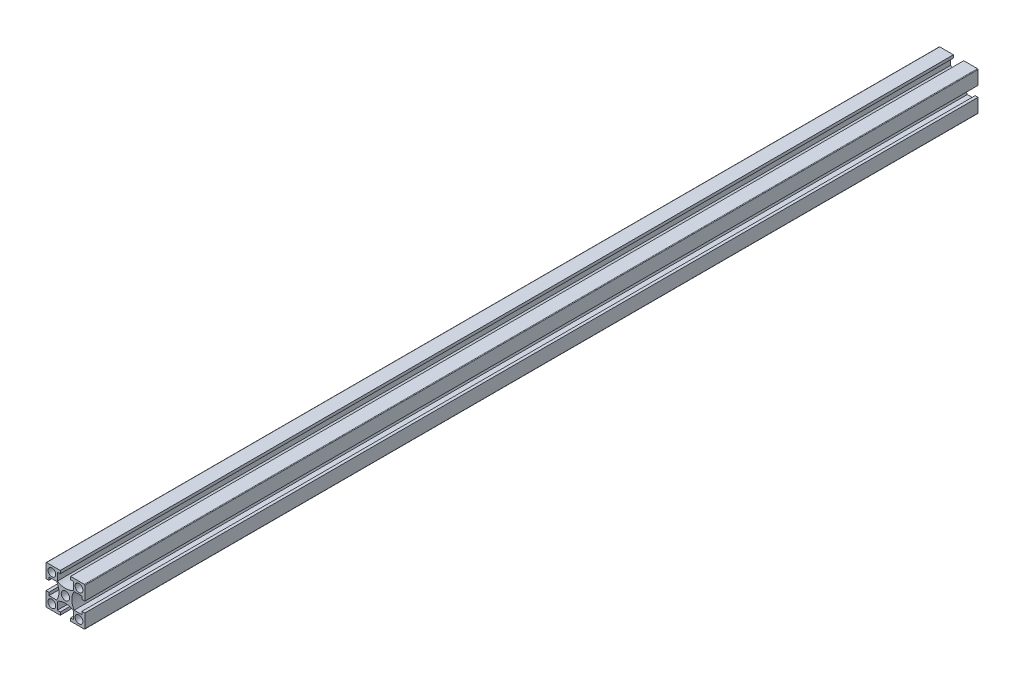
from build123d import *

# Parameters (mm, degrees)
SKETCH_1_W               = 20
SKETCH_1_H               = 20
SKETCH_1_R               = 2
SKETCH_1_R_2             = 2.15
EXTRUDE_1_DEPTH          = 460
CUT_EXTRUDE_1_REACH      = 462.217
PATTERN_CIRCULAR_1_COUNT = 4
FILLET_1_R               = 0.3
SKETCH_2_R               = 2.5
CUT_EXTRUDE_2_DEPTH      = 461.543157587
SKETCH_3_R               = 2.15
CUT_EXTRUDE_3_DEPTH      = 461.543157687
SKETCH_4_R               = 2.15
SKETCH_4_R_2             = 2.5
CUT_EXTRUDE_4_DEPTH      = 461.543157687


with BuildPart() as part:
    # 스케치1 → 보스-돌출1 (new body)
    with BuildSketch(Plane.XY):
        Rectangle(SKETCH_1_W, SKETCH_1_H)
        with Locations((-7, -7)):
            Circle(SKETCH_1_R, mode=Mode.SUBTRACT)
        with Locations((7, -7)):
            Circle(SKETCH_1_R, mode=Mode.SUBTRACT)
        with Locations((-7, 7)):
            Circle(SKETCH_1_R, mode=Mode.SUBTRACT)
        Circle(SKETCH_1_R_2, mode=Mode.SUBTRACT)
        with Locations((7, 7)):
            Circle(SKETCH_1_R, mode=Mode.SUBTRACT)
    extrude(amount=EXTRUDE_1_DEPTH)

    # 스케치1<3> → 컷-돌출1 (cut, up to next)
    with BuildSketch(Plane.XY, mode=Mode.PRIVATE) as cut_extrude_1_sk1:
        with BuildLine():
            Line((-8.5, 2.65), (-10, 2.65))
            Line((-10, 2.65), (-10, -2.65))
            Line((-10, -2.65), (-8.5, -2.65))
            Line((-8.5, -2.65), (-8.5, -4.15))
            Line((-8.5, -4.15), (-4.503166667, -4.15))
            ThreePointArc((-4.503166667, -4.15), (-3.3, 0), (-4.503166667, 4.15))
            Line((-4.503166667, 4.15), (-8.5, 4.15))
            Line((-8.5, 4.15), (-8.5, 2.65))
        make_face()
    cut_extrude_1_tool1 = extrude(cut_extrude_1_sk1.sketch, amount=CUT_EXTRUDE_1_REACH, mode=Mode.PRIVATE) & part.part
    cut_extrude_1 = cut_extrude_1_tool1.solids().sort_by_distance((-6.606913, 0, 0))[0]
    add(cut_extrude_1, mode=Mode.SUBTRACT)

    # 원형 패턴1: 컷-돌출1 ×4 about axis
    pattern_circular_1_axis = Axis((0, 0, 460), (0, 0, -1))
    for i in range(1, PATTERN_CIRCULAR_1_COUNT):
        add(cut_extrude_1.rotate(pattern_circular_1_axis, i * 360 / PATTERN_CIRCULAR_1_COUNT), mode=Mode.SUBTRACT)

    # 필렛1
    fillet_1_edges = [part.edges().sort_by_distance(p)[0] for p in [
        (10, -10, 230),
        (-10, -10, 230),
        (-10, 10, 230),
        (10, 10, 230),
    ]]
    fillet(fillet_1_edges, radius=FILLET_1_R)

    # 스케치2 → 컷-돌출2 (cut, through all)
    with BuildSketch(Plane.ZY.offset(10)):
        with Locations((31, 0)):
            Circle(SKETCH_2_R)
        with Locations((429, 0)):
            Circle(SKETCH_2_R)
    extrude(amount=-CUT_EXTRUDE_2_DEPTH, mode=Mode.SUBTRACT)

    # 스케치3 → 컷-돌출3 (cut, through all)
    with BuildSketch(Plane(origin=(0, 10, 0), x_dir=(1, 0, 0), z_dir=(0, 1, 0))):
        with Locations((0, -10)):
            Circle(SKETCH_3_R)
        with Locations((0, -450)):
            Circle(SKETCH_3_R)
    extrude(amount=-CUT_EXTRUDE_3_DEPTH, mode=Mode.SUBTRACT)

    # 스케치4 → 컷-돌출4 (cut, through all)
    with BuildSketch(Plane.ZY.offset(10)):
        with Locations((10, 0)):
            Circle(SKETCH_4_R)
        with Locations((450, 0)):
            Circle(SKETCH_4_R)
        with Locations((270, 0)):
            Circle(SKETCH_4_R_2)
        with Locations((190, 0)):
            Circle(SKETCH_4_R_2)
    extrude(amount=-CUT_EXTRUDE_4_DEPTH, mode=Mode.SUBTRACT)


solid = part.part
